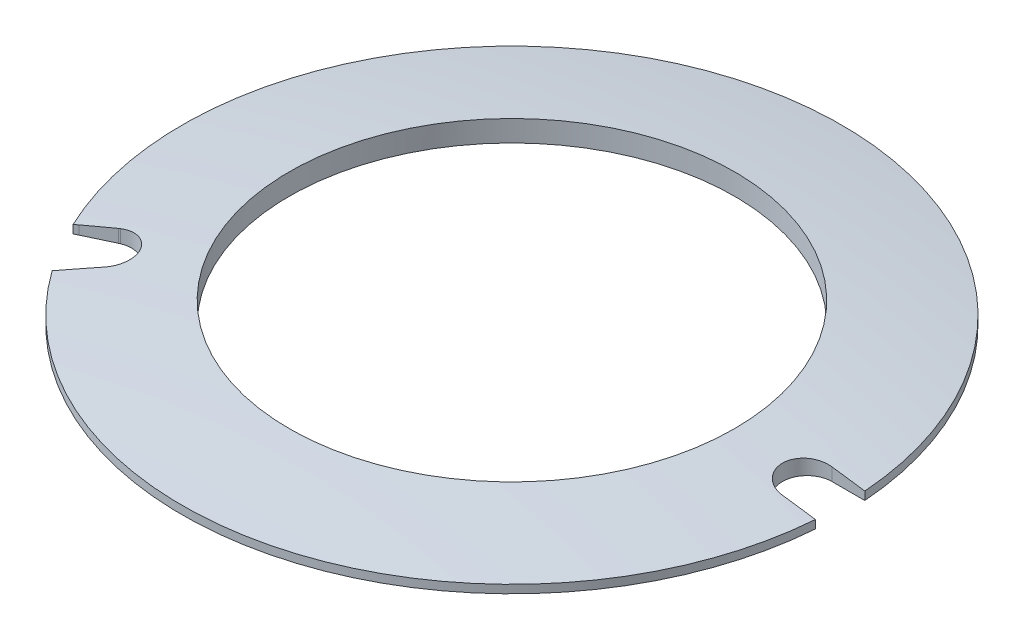
from build123d import *

# Parameters (mm, degrees)
SKETCH2_R          = 27.07
CUT_EXTRUDE1_DEPTH = 57.826471417
CUT_EXTRUDE2_DEPTH = 57.751328684


with BuildPart() as part:
    # Sketch1 → Revolve1 (revolve)
    with BuildSketch(Plane.XY, mode=Mode.PRIVATE) as revolve1_sk:
        with BuildLine():
            Line((0, 274.730375326), (0, 278.62799759))
            ThreePointArc((0, 278.62799759), (-20.096171352, 277.90264829), (-40.0877562, 275.730375326))
            Line((-40.0877562, 275.730375326), (-40.0877562, 274.730375326))
            Line((-40.0877562, 274.730375326), (0, 274.730375326))
        make_face()
    revolve(revolve1_sk.sketch.rotate(Axis((0, 274.730375326, 0), (0, 1, 0)), 180), axis=Axis((0, 274.730375326, 0), (0, 1, 0)))

    # Sketch2 → Cut-Extrude1 (cut, through all)
    with BuildSketch(Plane.XZ.offset(-274.730375326)):
        Circle(SKETCH2_R)
    extrude(amount=-CUT_EXTRUDE1_DEPTH, mode=Mode.SUBTRACT)

    # Sketch3 → Cut-Extrude2 (cut, through all)
    with BuildSketch(Plane.XZ.offset(-274.730375326)):
        with BuildLine():
            ThreePointArc((35.969379126, 3.060672496), (32.969379126, 0.060672496), (35.969379126, -2.939327504))
            Line((35.969379126, -2.939327504), (39.794982501, -2.939327504))
            Line((39.794982501, -2.939327504), (39.979851813, -2.939327504))
            ThreePointArc((39.979851813, -2.939327504), (40.060771021, -1.470653726), (40.0877562, 0))
            ThreePointArc((40.0877562, 0), (40.058492798, 1.531454184), (39.970745315, 3.060672496))
            Line((39.970745315, 3.060672496), (39.620602336, 3.060672496))
            Line((39.620602336, 3.060672496), (35.969379126, 3.060672496))
        make_face()
        with BuildLine():
            ThreePointArc((-32.639301422, 23.274539735), (-34.579017235, 20.281019804), (-36.244953393, 17.126924731))
            Line((-36.244953393, 17.126924731), (-35.772259135, 16.89450589))
            Line((-35.772259135, 16.89450589), (-32.485811652, 15.346633099))
            Line((-32.485811652, 15.346633099), (-32.318603486, 15.274002848))
            ThreePointArc((-32.318603486, 15.274002848), (-28.645274369, 16.500282047), (-29.241556833, 20.3267105))
            Line((-29.241556833, 20.3267105), (-32.244598709, 22.93210193))
            Line((-32.244598709, 22.93210193), (-32.639301422, 23.274539735))
        make_face()
    extrude(amount=-CUT_EXTRUDE2_DEPTH, mode=Mode.SUBTRACT)


solid = part.part
